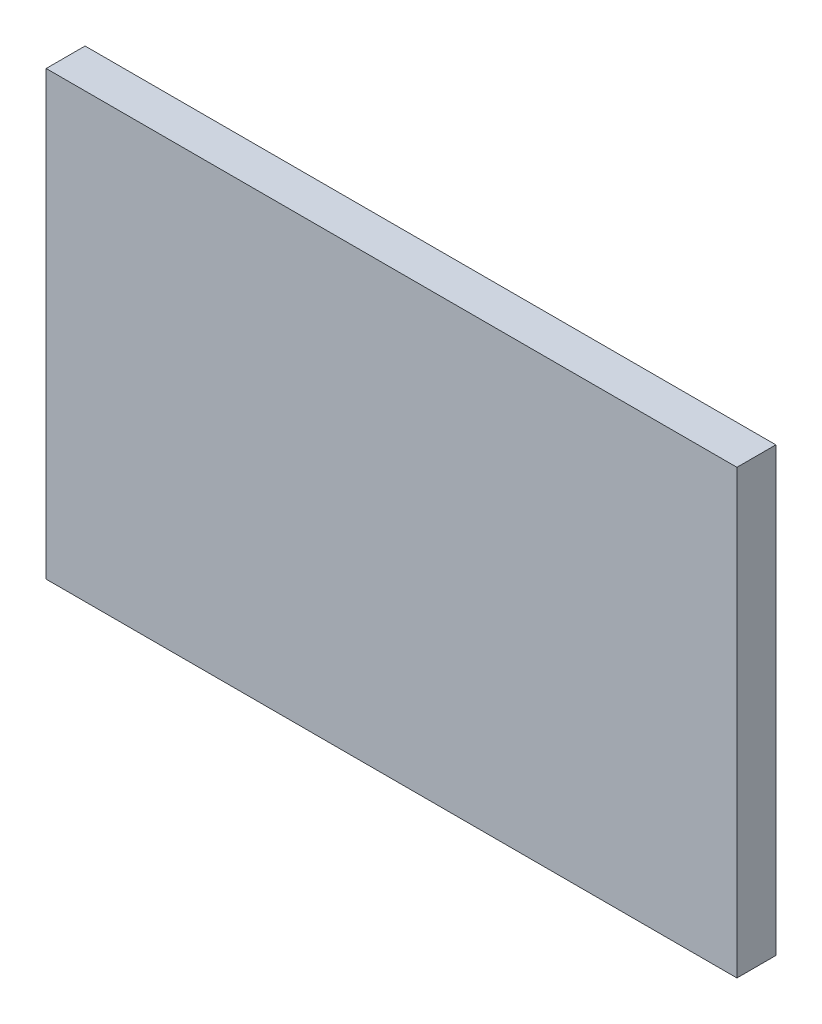
from build123d import *

# Parameters (mm, degrees)
SKETCH1_W           = 99.176616
SKETCH1_H           = 63.5
BOSS_EXTRUDE1_DEPTH = 5.588


with BuildPart() as part:
    # Sketch1 → Boss-Extrude1 (new body)
    with BuildSketch(Plane.XY):
        Rectangle(SKETCH1_W, SKETCH1_H)
    extrude(amount=BOSS_EXTRUDE1_DEPTH)


solid = part.part
